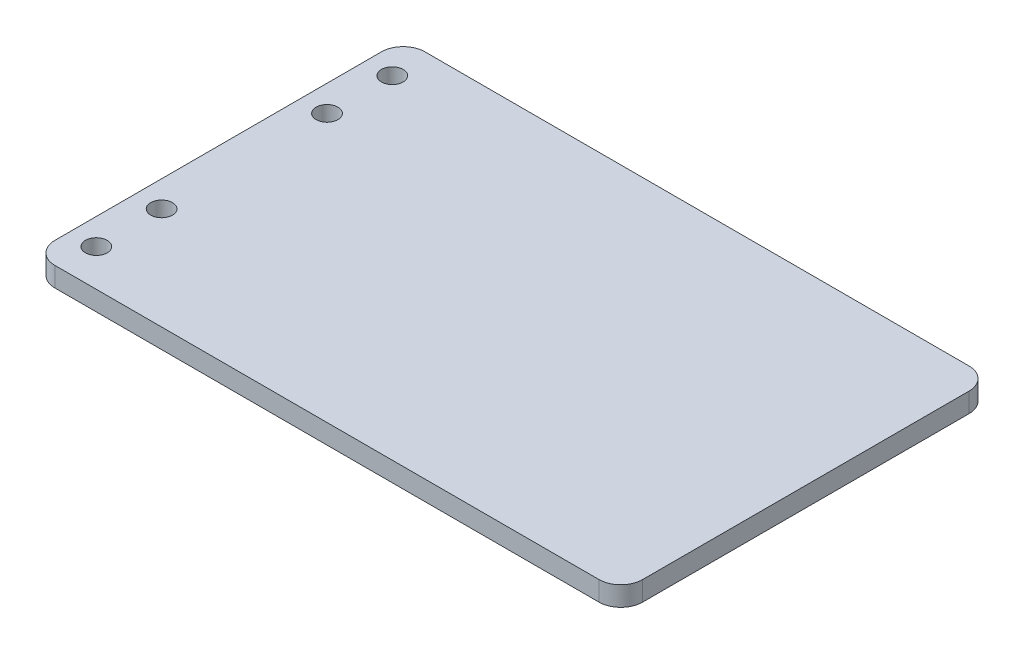
from build123d import *

# Parameters (mm, degrees)
RESSALTO_EXTRUS_O1_DEPTH = 0.45
ESBO_O2_R                = 0.5
CORTE_EXTRUS_O1_DEPTH    = 16.978422951


with BuildPart() as part:
    # Esboço1 → Ressalto-extrusão1 (new, symmetric)
    with BuildSketch(Plane(origin=(0, 0, 0), x_dir=(1, 0, 0), z_dir=(0, 1, 0))):
        with BuildLine():
            Line((12.5, -8.5), (-12.5, -8.5))
            ThreePointArc((-12.5, -8.5), (-13.207106781, -8.207106781), (-13.5, -7.5))
            Line((-13.5, -7.5), (-13.5, 7.5))
            ThreePointArc((-13.5, 7.5), (-13.207106781, 8.207106781), (-12.5, 8.5))
            Line((-12.5, 8.5), (12.5, 8.5))
            ThreePointArc((12.5, 8.5), (13.207106781, 8.207106781), (13.5, 7.5))
            Line((13.5, 7.5), (13.5, -7.5))
            ThreePointArc((13.5, -7.5), (13.207106781, -8.207106781), (12.5, -8.5))
        make_face()
    extrude(amount=RESSALTO_EXTRUS_O1_DEPTH, both=True)

    # Esboço2 → Corte-extrusão1 (cut, through all)
    with BuildSketch(Plane(origin=(0, 0.45, 0), x_dir=(1, 0, 0), z_dir=(0, 1, 0))):
        with Locations(Location((-12.3, 3.8, 0), (0, 0, 270))):
            Circle(ESBO_O2_R)
        with Locations(Location((-12.3, 6.8, 0), (0, 0, 270))):
            Circle(ESBO_O2_R)
        with Locations(Location((-12.3, -6.8, 0), (0, 0, 90))):
            Circle(ESBO_O2_R)
        with Locations(Location((-12.3, -3.8, 0), (0, 0, 90))):
            Circle(ESBO_O2_R)
    extrude(amount=-CORTE_EXTRUS_O1_DEPTH, mode=Mode.SUBTRACT)


solid = part.part
